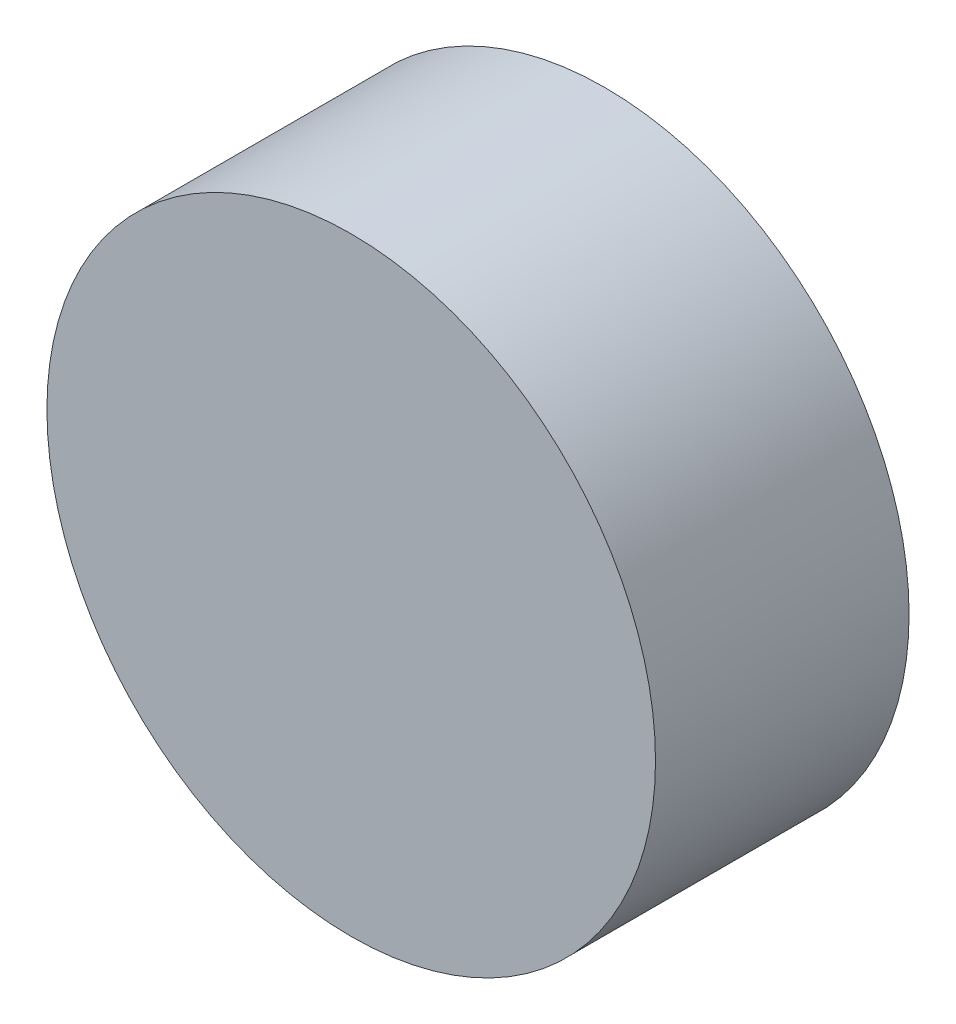
from build123d import *

# Parameters (mm, degrees)
SKETCH_1_R      = 3.6
EXTRUDE_1_DEPTH = 3


with BuildPart() as part:
    # 草圖1 → 填料-伸長1 (new body)
    with BuildSketch(Plane.XY):
        with Locations((-267.499543018, 75.885430609)):
            Circle(SKETCH_1_R)
    extrude(amount=-EXTRUDE_1_DEPTH)


solid = part.part
